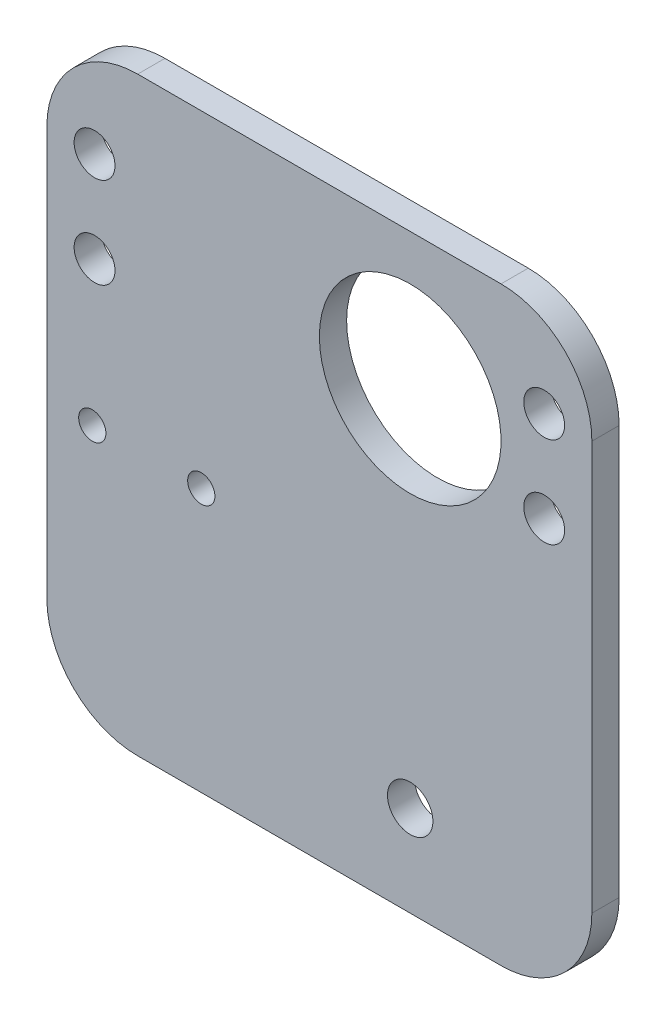
from build123d import *

# Parameters (mm, degrees)
SKETCH_3_R               = 3
EXTRUDE_6_DEPTH          = 0.001
EXTRUDE_6_2_DEPTH        = 0.001
EXTRUDE_6_3_DEPTH        = 0.001
EXTRUDE_6_4_DEPTH        = 0.001
CUT_EXTRUDE_2_DEPTH      = 67.213034483
CUT_EXTRUDE_2_DEPTH_BACK = 67.213034483
SKETCH_11_R              = 2.25
EXTRUDE_7_DEPTH          = 3
CUT_EXTRUDE_START        = -3
SKETCH_14_R              = 2.25
SKETCH_14_R_2            = 10
CUT_EXTRUDE_3_DEPTH      = 3
SKETCH_15_R              = 10
SKETCH_15_R_2            = 2.5
CUT_EXTRUDE_4_DEPTH      = 3
SKETCH_16_R              = 1.5
CUT_EXTRUDE_5_DEPTH      = 10
SKETCH_17_R              = 9.5
SKETCH_17_R_2            = 7.5
EXTRUDE_8_DEPTH          = 4.9
FILLET_1_R               = 10


with BuildPart() as part:
    # 草图3 → 凸台-拉伸6 (new body)
    with BuildSketch(Plane.XY):
        with Locations((60.266478541, 16.532501821)):
            Circle(SKETCH_3_R)
    extrude(amount=EXTRUDE_6_DEPTH)


with BuildPart() as body_2:
    # 草图3 → Extrude 6 2 (new body)
    with BuildSketch(Plane.XY):
        with Locations((60.266478541, 6.532501821)):
            Circle(SKETCH_3_R)
    extrude(amount=EXTRUDE_6_2_DEPTH)


with BuildPart() as body_3:
    # 草图3 → Extrude 6 3 (new body)
    with BuildSketch(Plane.XY):
        with Locations((10.766478541, 6.532501821)):
            Circle(SKETCH_3_R)
    extrude(amount=EXTRUDE_6_3_DEPTH)


with BuildPart() as body_4:
    # 草图3 → Extrude 6 4 (new body)
    with BuildSketch(Plane.XY):
        with Locations((10.766478541, 16.532501821)):
            Circle(SKETCH_3_R)
    extrude(amount=EXTRUDE_6_4_DEPTH)


with BuildPart() as cut_extrude_2_tool:
    # 草图11 → 切除-拉伸2 (new, two sides: drawn at the far end of the back side and taken through both)
    with BuildSketch(Plane.XY.offset(0.001).offset(-CUT_EXTRUDE_2_DEPTH_BACK)):
        with Locations((10.766478541, 16.532501821)):
            Circle(SKETCH_11_R)
        with Locations((10.766478541, 6.532501821)):
            Circle(SKETCH_11_R)
        with Locations((60.266478541, 16.532501821)):
            Circle(SKETCH_11_R)
        with Locations((60.266478541, 6.532501821)):
            Circle(SKETCH_11_R)
    extrude(amount=CUT_EXTRUDE_2_DEPTH + CUT_EXTRUDE_2_DEPTH_BACK)


with BuildPart() as part_1:
    add(part.part)

    # 切除-拉伸2: cut by cut_extrude_2_tool
    add(cut_extrude_2_tool.part, mode=Mode.SUBTRACT)



with BuildPart() as body_2_1:
    add(body_2.part)

    # 切除-拉伸2: cut by cut_extrude_2_tool
    add(cut_extrude_2_tool.part, mode=Mode.SUBTRACT)


with BuildPart() as body_3_1:
    add(body_3.part)

    # 切除-拉伸2: cut by cut_extrude_2_tool
    add(cut_extrude_2_tool.part, mode=Mode.SUBTRACT)


with BuildPart() as body_4_1:
    add(body_4.part)

    # 切除-拉伸2: cut by cut_extrude_2_tool
    add(cut_extrude_2_tool.part, mode=Mode.SUBTRACT)


with BuildPart() as part_2:
    add(part_1.part)

    add(body_2_1.part)  # 凸台-拉伸7 merges body 2

    add(body_3_1.part)  # 凸台-拉伸7 merges body 3

    add(body_4_1.part)  # 凸台-拉伸7 merges body 4
    # 草图12 → 凸台-拉伸7 (add)
    with BuildSketch(Plane.XY.offset(0.001)):
        Polygon((5.516478541, 26.532501821), (65.516478541, 26.532501821), (65.516478541, -38.467498179), (5.516478541, -38.467498179), (5.516478541, 1.532501821), align=None)
    extrude(amount=EXTRUDE_7_DEPTH)

    # 草图14 → 切除-拉伸3 (cut)
    with BuildSketch(Plane(origin=(0, 0, 0.001), x_dir=(-1, 0, 0), z_dir=(0, 0, -1)).offset(CUT_EXTRUDE_START)):
        with Locations(Location((-60.266478541, 6.532501821, 0), (0, 0, 180))):
            Circle(SKETCH_14_R)
        with Locations(Location((-60.266478541, 16.532501821, 0), (0, 0, 180))):
            Circle(SKETCH_14_R)
        with Locations(Location((-10.766478541, 6.532501821, 0), (0, 0, 180))):
            Circle(SKETCH_14_R)
        with Locations(Location((-10.766478541, 16.532501821, 0), (0, 0, 180))):
            Circle(SKETCH_14_R)
        with Locations((-45.516478541, 11.532501821)):
            Circle(SKETCH_14_R_2)
    extrude(amount=CUT_EXTRUDE_3_DEPTH, mode=Mode.SUBTRACT)

    # 草图15 → 切除-拉伸4 (cut)
    with BuildSketch(Plane(origin=(0, 0, 0.001), x_dir=(-1, 0, 0), z_dir=(0, 0, -1)).offset(CUT_EXTRUDE_START)):
        with Locations((-45.516478541, 11.532501821)):
            Circle(SKETCH_15_R)
        with Locations((-45.516478541, -28.467498179)):
            Circle(SKETCH_15_R_2)
    extrude(amount=CUT_EXTRUDE_4_DEPTH, mode=Mode.SUBTRACT)

    # 草图16 → 切除-拉伸5 (cut)
    with BuildSketch(Plane.XY.offset(3.001)):
        with Locations((10.516478541, -9.467498179)):
            Circle(SKETCH_16_R)
        with Locations((22.516478541, -9.467498179)):
            Circle(SKETCH_16_R)
    extrude(amount=-CUT_EXTRUDE_5_DEPTH, mode=Mode.SUBTRACT)

    # 草图17 → 凸台-拉伸8 (add)
    with BuildSketch(Plane.XY.offset(3.001)):
        with Locations((45.516478541, -28.467498179)):
            Circle(SKETCH_17_R)
        with Locations((45.516478541, -28.467498179)):
            Circle(SKETCH_17_R_2, mode=Mode.SUBTRACT)
    extrude(amount=-EXTRUDE_8_DEPTH)

    # 圆角1
    fillet_1_edges = [part_2.edges().sort_by_distance(p)[0] for p in [
        (5.516478541, 26.532501821, 1.501),
        (5.516478541, -38.467498179, 1.501),
        (65.516478541, -38.467498179, 1.501),
        (65.516478541, 26.532501821, 1.501),
    ]]
    fillet(fillet_1_edges, radius=FILLET_1_R)


solid = part_2.part
